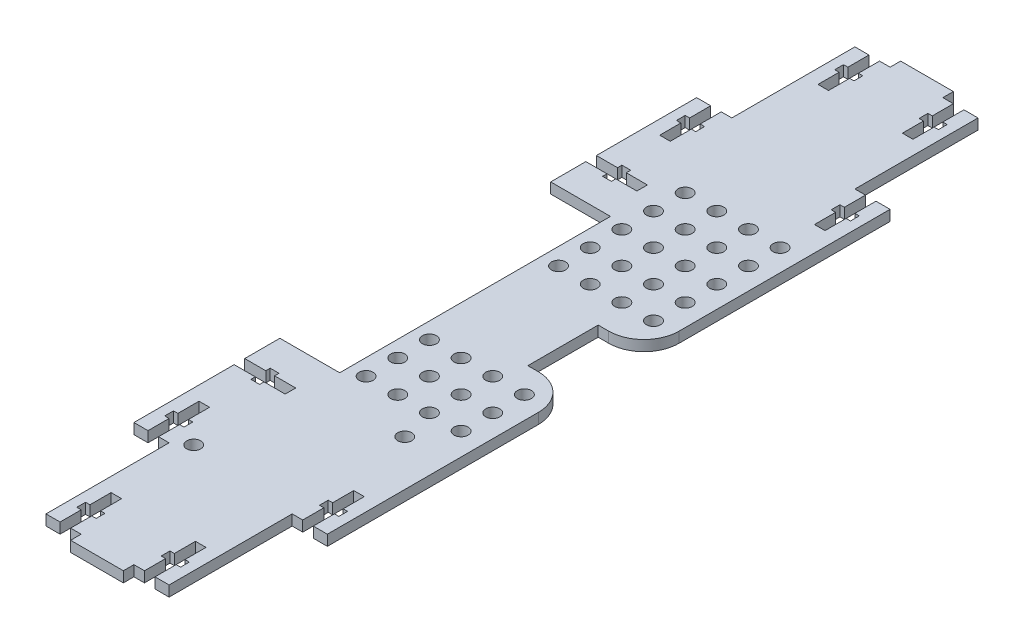
from build123d import *

# Parameters (mm, degrees)
SKETCH_1_W                  = 55
SKETCH_1_H                  = 160
EXTRUDE_1_DEPTH             = 3
EXTRUDE_2_DEPTH             = 35
EXTRUDE_2_DEPTH_BACK        = 195
SKETCH_2_W                  = 35
SKETCH_2_H                  = 3
EXTRUDE_3_DEPTH             = 3
EXTRUDE_3_DEPTH_BACK        = 233
SKETCH_3_W                  = 15
SKETCH_3_H                  = 3
CUT_EXTRUDE_1_DEPTH         = 3
CUT_EXTRUDE_2_DEPTH         = 3
SKETCH_6_W                  = 77
SKETCH_6_H                  = 3
CUT_EXTRUDE_3_DEPTH         = 17
SKETCH_8_R                  = 2
CUT_EXTRUDE_4_DEPTH         = 3
SKETCH_9_W                  = 13
SKETCH_9_H                  = 20
CUT_EXTRUDE_5_DEPTH         = 3
FILLET_1_R                  = 10
SKETCH_10_R                 = 2
CUT_EXTRUDE_6_DEPTH         = 10
PATTERN_LINEAR_1_COUNT      = 4
PATTERN_LINEAR_1_PITCH      = 9
PATTERN_LINEAR_1_COUNT_DIR2 = 3
PATTERN_LINEAR_1_PITCH_DIR2 = 9
SKETCH_11_R                 = 2
CUT_EXTRUDE_7_DEPTH         = 10
PATTERN_LINEAR_2_COUNT      = 5
PATTERN_LINEAR_2_PITCH      = 9
PATTERN_LINEAR_2_COUNT_DIR2 = 4
PATTERN_LINEAR_2_PITCH_DIR2 = 9


with BuildPart() as part:
    # Эскиз1 → Бобышка-Вытянуть1 (new body)
    with BuildSketch(Plane(origin=(0, 0, 0), x_dir=(1, 0, 0), z_dir=(0, 1, 0))):
        Rectangle(SKETCH_1_W, SKETCH_1_H)
    extrude(amount=EXTRUDE_1_DEPTH)

    # Эскиз2 → Бобышка-Вытянуть2 (add, two sides: drawn at the far end of the back side and taken through both)
    with BuildSketch(Plane(origin=(0, 0, -80), x_dir=(-1, 0, 0), z_dir=(0, 0, -1)).offset(-EXTRUDE_2_DEPTH_BACK)):
        with Locations((0, 1.5)):
            Rectangle(SKETCH_2_W, SKETCH_2_H)
    extrude(amount=EXTRUDE_2_DEPTH + EXTRUDE_2_DEPTH_BACK)

    # Эскиз3 → Бобышка-Вытянуть3 (add, two sides: drawn at the far end of the back side and taken through both)
    with BuildSketch(Plane(origin=(0, 0, -115), x_dir=(-1, 0, 0), z_dir=(0, 0, -1)).offset(-EXTRUDE_3_DEPTH_BACK)):
        with Locations((0, 1.5)):
            Rectangle(SKETCH_3_W, SKETCH_3_H)
    extrude(amount=EXTRUDE_3_DEPTH + EXTRUDE_3_DEPTH_BACK)

    # Эскиз4 → Вырез-Вытянуть1 (cut)
    with BuildSketch(Plane(origin=(0, 3, 0), x_dir=(1, 0, 0), z_dir=(0, 1, 0))):
        Polygon((-23.5, 80), (-23.5, 74), (-24.75, 74), (-24.75, 71.5), (-23.5, 71.5), (-23.5, 65.5), (-20.5, 65.5), (-20.5, 71.5), (-19.25, 71.5), (-19.25, 74), (-20.5, 74), (-20.5, 80), align=None)
        Polygon((-13.5, 115), (-13.5, 109), (-14.75, 109), (-14.75, 106.5), (-13.5, 106.5), (-13.5, 100.5), (-10.5, 100.5), (-10.5, 106.5), (-9.25, 106.5), (-9.25, 109), (-10.5, 109), (-10.5, 115), align=None)
        Polygon((10.5, 115), (13.5, 115), (13.5, 109), (14.75, 109), (14.75, 106.5), (13.5, 106.5), (13.5, 100.5), (10.5, 100.5), (10.5, 106.5), (9.25, 106.5), (9.25, 109), (10.5, 109), align=None)
        Polygon((20.5, 80), (23.5, 80), (23.5, 74), (24.75, 74), (24.75, 71.5), (23.5, 71.5), (23.5, 65.5), (20.5, 65.5), (20.5, 71.5), (19.25, 71.5), (19.25, 74), (20.5, 74), align=None)
        Polygon((-10.5, -115), (-13.5, -115), (-13.5, -109), (-14.75, -109), (-14.75, -106.5), (-13.5, -106.5), (-13.5, -100.5), (-10.5, -100.5), (-10.5, -106.5), (-9.25, -106.5), (-9.25, -109), (-10.5, -109), align=None)
        Polygon((13.5, -115), (13.5, -109), (14.75, -109), (14.75, -106.5), (13.5, -106.5), (13.5, -100.5), (10.5, -100.5), (10.5, -106.5), (9.25, -106.5), (9.25, -109), (10.5, -109), (10.5, -115), align=None)
        Polygon((-20.5, -80), (-23.5, -80), (-23.5, -74), (-24.75, -74), (-24.75, -71.5), (-23.5, -71.5), (-23.5, -65.5), (-20.5, -65.5), (-20.5, -71.5), (-19.25, -71.5), (-19.25, -74), (-20.5, -74), align=None)
        Polygon((23.5, -80), (23.5, -74), (24.75, -74), (24.75, -71.5), (23.5, -71.5), (23.5, -65.5), (20.5, -65.5), (20.5, -71.5), (19.25, -71.5), (19.25, -74), (20.5, -74), (20.5, -80), align=None)
    extrude(amount=-CUT_EXTRUDE_1_DEPTH, mode=Mode.SUBTRACT)

    # Эскиз5 → Вырез-Вытянуть2 (cut)
    with BuildSketch(Plane(origin=(0, 3, 0), x_dir=(1, 0, 0), z_dir=(0, 1, 0))):
        Polygon((-27.5, 51.5), (-21.5, 51.5), (-21.5, 52.75), (-19, 52.75), (-19, 51.5), (-13, 51.5), (-13, 48.5), (-19, 48.5), (-19, 47.25), (-21.5, 47.25), (-21.5, 48.5), (-27.5, 48.5), align=None)
        Polygon((-27.5, -48.5), (-27.5, -51.5), (-21.5, -51.5), (-21.5, -52.75), (-19, -52.75), (-19, -51.5), (-13, -51.5), (-13, -48.5), (-19, -48.5), (-19, -47.25), (-21.5, -47.25), (-21.5, -48.5), align=None)
    extrude(amount=-CUT_EXTRUDE_2_DEPTH, mode=Mode.SUBTRACT)

    # Эскиз6 → Вырез-Вытянуть3 (cut)
    with BuildSketch(Plane.ZY.offset(27.5)):
        with Locations((0, 1.5)):
            Rectangle(SKETCH_6_W, SKETCH_6_H)
    extrude(amount=-CUT_EXTRUDE_3_DEPTH, mode=Mode.SUBTRACT)

    # Эскиз8 → Вырез-Вытянуть4 (cut)
    with BuildSketch(Plane(origin=(0, 3, 0), x_dir=(1, 0, 0), z_dir=(0, 1, 0))):
        with Locations(Location((-13.5, -77, 0), (0, 0, 270))):
            Circle(SKETCH_8_R)
        with Locations(Location((14.5, -45, 0), (0, 0, 270))):
            Circle(SKETCH_8_R)
    extrude(amount=-CUT_EXTRUDE_4_DEPTH, mode=Mode.SUBTRACT)

    # Эскиз9 → Вырез-Вытянуть5 (cut)
    with BuildSketch(Plane(origin=(0, 3, 0), x_dir=(1, 0, 0), z_dir=(0, 1, 0))):
        with Locations((21, 0)):
            Rectangle(SKETCH_9_W, SKETCH_9_H)
    extrude(amount=-CUT_EXTRUDE_5_DEPTH, mode=Mode.SUBTRACT)

    # Скругление1
    fillet_1_edges = [part.edges().sort_by_distance(p)[0] for p in [
        (27.5, 1.5, -10),
        (27.5, 1.5, 10),
    ]]
    fillet(fillet_1_edges, radius=FILLET_1_R)

    # Эскиз10 → Вырез-Вытянуть6 (cut)
    with BuildSketch(Plane(origin=(0, 3, 0), x_dir=(1, 0, 0), z_dir=(0, 1, 0))):
        with Locations(Location((21.127265004, -35.602070686, 0), (0, 0, 270))):
            Circle(SKETCH_10_R)
    cut_extrude_6 = extrude(amount=-CUT_EXTRUDE_6_DEPTH, mode=Mode.SUBTRACT)

    # Линейный массив1: Cut-Extrude 6 4 × 3
    with Locations(*[(-i * PATTERN_LINEAR_1_PITCH, 0, -j * PATTERN_LINEAR_1_PITCH_DIR2) for i in range(PATTERN_LINEAR_1_COUNT) for j in range(PATTERN_LINEAR_1_COUNT_DIR2) if (i, j) != (0, 0)]):
        add(cut_extrude_6, mode=Mode.SUBTRACT)

    # Эскиз11 → Вырез-Вытянуть7 (cut)
    with BuildSketch(Plane(origin=(0, 3, 0), x_dir=(1, 0, 0), z_dir=(0, 1, 0))):
        with Locations(Location((21.311341687, 18.91955772, 0), (0, 0, 270))):
            Circle(SKETCH_11_R)
    cut_extrude_7 = extrude(amount=-CUT_EXTRUDE_7_DEPTH, mode=Mode.SUBTRACT)

    # Линейный массив2: Cut-Extrude 7 5 × 4
    with Locations(*[(-j * PATTERN_LINEAR_2_PITCH_DIR2, 0, -i * PATTERN_LINEAR_2_PITCH) for i in range(PATTERN_LINEAR_2_COUNT) for j in range(PATTERN_LINEAR_2_COUNT_DIR2) if (i, j) != (0, 0)]):
        add(cut_extrude_7, mode=Mode.SUBTRACT)


solid = part.part
